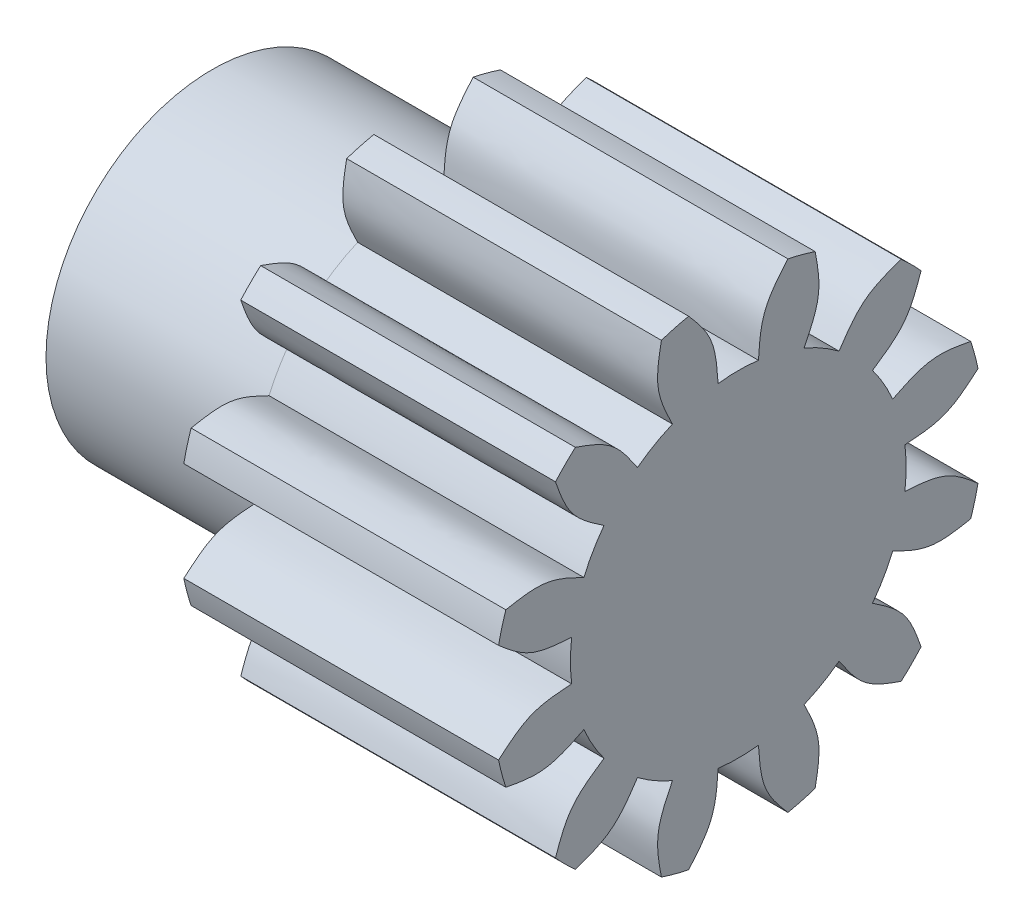
from build123d import *

# Parameters (mm, degrees)
KUGGLUCKA_DEPTH    = 15
CIRPATTERN_COUNT   = 12
CUT_EXTRUDE1_DEPTH = 6
CUT_EXTRUDE2_START = -10
SKETCH2_R          = 4.5
CUT_EXTRUDE2_DEPTH = 10
SKETCH4_R          = 7.456083996
SKETCH4_R_2        = 0.007636476
SKETCH4_R_3        = 4.7534348
CUT_EXTRUDE4_DEPTH = 6
SKETCH5_R          = 1.5
CUT_EXTRUDE5_DEPTH = 6


with BuildPart() as part:
    # Ritning 1 → Kugghjulsämne (revolve)
    with BuildSketch(Plane.XY, mode=Mode.PRIVATE) as kugghjuls_mne_sk:
        Polygon((12.5, 1), (2.5, 1), (2.5, 3.5), (-12.5, 3.5), (-12.5, -3.5), (12.5, -3.5), align=None)
    revolve(kugghjuls_mne_sk.sketch.rotate(Axis((-12.5, -3.5, 0), (1, 0, 0)), 90), axis=Axis((-12.5, -3.5, 0), (1, 0, 0)))

    # Ritning 2 → Kugglucka (cut)
    with BuildSketch(Plane.ZY.offset(12.5)):
        with BuildLine():
            Line((1.419865071, 3.354486354), (0, 4.774351425))
            Line((0, 4.774351425), (-1.419865071, 3.354486354))
            add(Edge.make_bspline(
                [(-1.419865071, 3.354486354), (-1.173032372, 3.067088657), (-0.658113481, 2.467546927), (-0.604624671, 1.6768746), (-0.576776379, 1.265220772)],
                knots=[0, 0, 0, 0, 0.479362292, 1, 1, 1, 1], degree=3))
            ThreePointArc((-0.576776379, 1.265220772), (0, 1.3), (0.576776379, 1.265220772))
            add(Edge.make_bspline(
                [(1.419865071, 3.354486354), (1.173032372, 3.067088657), (0.658113481, 2.467546927), (0.604624671, 1.6768746), (0.576776379, 1.265220772)],
                knots=[0, 0, 0, 0, 0.479362292, 1, 1, 1, 1], degree=3))
        make_face()
    kugglucka = extrude(amount=-KUGGLUCKA_DEPTH, mode=Mode.SUBTRACT)

    # CirPattern: Kugglucka ×12 about axis
    cirpattern_axis = Axis((-12.5, -3.5, 0), (-1, 0, 0))
    for i in range(1, CIRPATTERN_COUNT):
        add(kugglucka.rotate(cirpattern_axis, i * 360 / CIRPATTERN_COUNT), mode=Mode.SUBTRACT)

    # Sketch1 → Cut-Extrude1 (cut)
    with BuildSketch(Plane.ZY.offset(12.5)):
        with BuildLine():
            Line((-1.25, -1.63023162), (-1.25, -5.371889007))
            ThreePointArc((-1.25, -5.371889007), (2.25, -3.501060314), (-1.25, -1.63023162))
        make_face()
    extrude(amount=-CUT_EXTRUDE1_DEPTH, mode=Mode.SUBTRACT)

    # Sketch2 → Cut-Extrude2 (cut)
    with BuildSketch(Plane(origin=(12.5, 0, 0), x_dir=(0, 0, -1), z_dir=(1, 0, 0)).offset(CUT_EXTRUDE2_START)):
        with Locations((0, -3.5)):
            Circle(SKETCH2_R)
    extrude(amount=CUT_EXTRUDE2_DEPTH, mode=Mode.SUBTRACT)

    # Sketch4 → Cut-Extrude4 (cut)
    with BuildSketch(Plane.ZY.offset(12.5)):
        with Locations((0.041266339, -3.478426703)):
            Circle(SKETCH4_R)
        with Locations((2.448771632, -7.637255851)):
            Circle(SKETCH4_R_2, mode=Mode.SUBTRACT)
        with Locations((0.041266339, -3.478426703)):
            Circle(SKETCH4_R_3, mode=Mode.SUBTRACT)
    extrude(amount=-CUT_EXTRUDE4_DEPTH, mode=Mode.SUBTRACT)

    # Sketch5 → Cut-Extrude5 (cut)
    with BuildSketch(Plane.XY):
        with Locations((-9.5, -3.159325549)):
            Circle(SKETCH5_R)
    extrude(amount=-CUT_EXTRUDE5_DEPTH, mode=Mode.SUBTRACT)


solid = part.part
